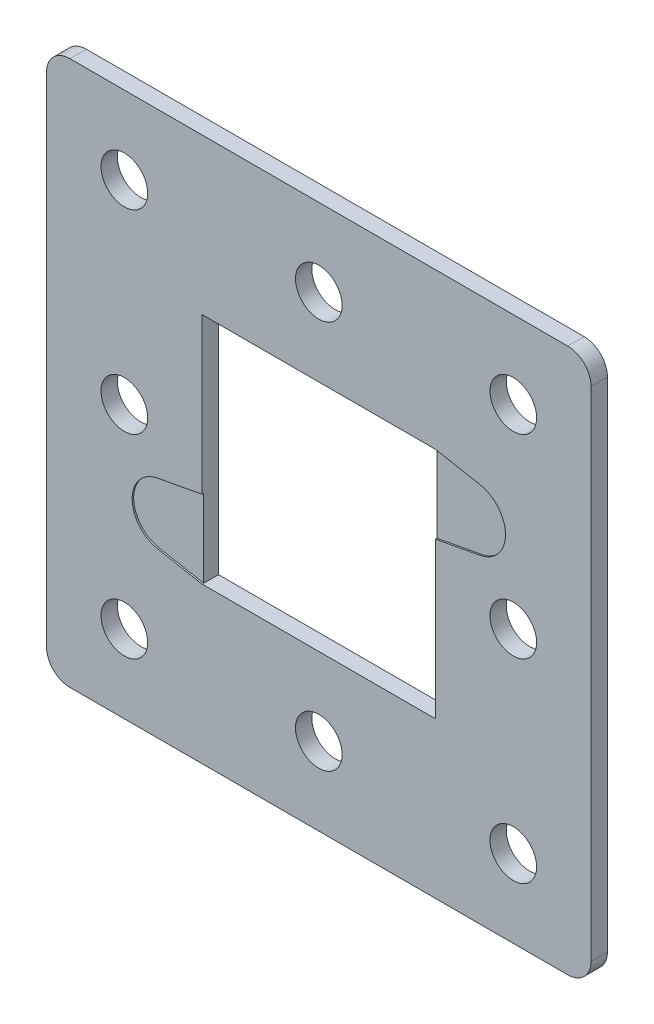
from build123d import *

# Parameters (mm, degrees)
SKETCH3_W           = 70
SKETCH3_H           = 70
BOSS_EXTRUDE1_DEPTH = 2.105
SKETCH6_R           = 3
SKETCH6_W           = 30
SKETCH6_H           = 30
CUT_EXTRUDE5_DEPTH  = 2.105
CUT_EXTRUDE7_DEPTH  = 0.2
FILLET1_R           = 3


with BuildPart() as part:
    # Sketch3 → Boss-Extrude1 (new body)
    with BuildSketch(Plane.XY):
        Rectangle(SKETCH3_W, SKETCH3_H)
    extrude(amount=BOSS_EXTRUDE1_DEPTH)

    # Sketch6 → Cut-Extrude5 (cut)
    with BuildSketch(Plane.XY.offset(2.105)):
        with Locations((0, 25)):
            Circle(SKETCH6_R)
        with Locations((25, 25)):
            Circle(SKETCH6_R)
        with Locations((25, 0)):
            Circle(SKETCH6_R)
        with Locations((25, -25)):
            Circle(SKETCH6_R)
        with Locations((0, -25)):
            Circle(SKETCH6_R)
        with Locations((-25, -25)):
            Circle(SKETCH6_R)
        with Locations((-25, 0)):
            Circle(SKETCH6_R)
        with Locations((-25, 25)):
            Circle(SKETCH6_R)
        Rectangle(SKETCH6_W, SKETCH6_H)
    extrude(amount=-CUT_EXTRUDE5_DEPTH, mode=Mode.SUBTRACT)

    # Sketch8 → Cut-Extrude7 (cut)
    with BuildSketch(Plane.XY.offset(2.105)):
        with BuildLine():
            Line((15, 5), (15, 15))
            Line((15, 15), (20.732380758, 13.932380758))
            ThreePointArc((20.732380758, 13.932380758), (24, 10), (20.732380758, 6.067619242))
            Line((20.732380758, 6.067619242), (15, 5))
        make_face()
        with BuildLine():
            Line((-15, -15), (-20.732380758, -13.932380758))
            ThreePointArc((-20.732380758, -13.932380758), (-24, -10), (-20.732380758, -6.067619242))
            Line((-20.732380758, -6.067619242), (-15, -5))
            Line((-15, -5), (-15, -15))
        make_face()
    extrude(amount=-CUT_EXTRUDE7_DEPTH, mode=Mode.SUBTRACT)

    # Fillet1
    fillet1_edges = [part.edges().sort_by_distance(p)[0] for p in [
        (35, -35, 1.0525),
        (-35, -35, 1.0525),
        (-35, 35, 1.0525),
        (35, 35, 1.0525),
    ]]
    fillet(fillet1_edges, radius=FILLET1_R)


solid = part.part
